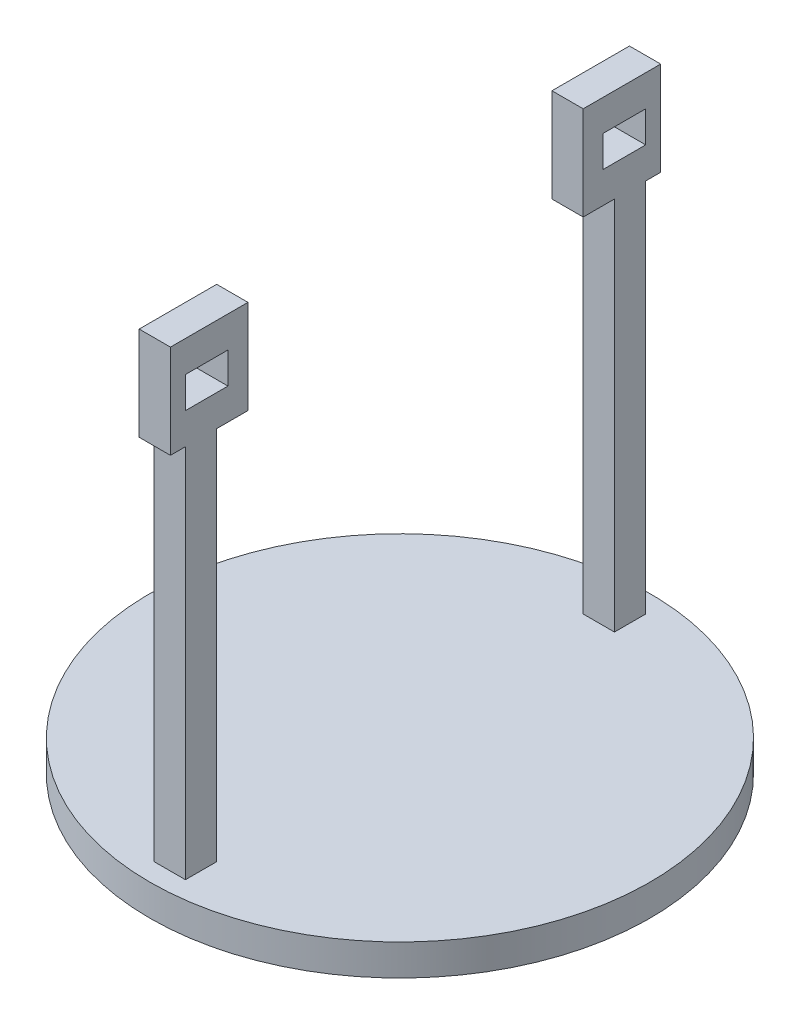
from build123d import *

# Parameters (mm, degrees)
SKETCH1_R           = 50.8
BOSS_EXTRUDE1_DEPTH = 6.35
SKETCH9_W           = 8.636
SKETCH9_H           = 6.35
BOSS_EXTRUDE5_DEPTH = 3.175


with BuildPart() as part:
    # Sketch1 → Boss-Extrude1 (new body)
    with BuildSketch(Plane(origin=(0, 0, 0), x_dir=(1, 0, 0), z_dir=(0, 1, 0))):
        Circle(SKETCH1_R)
    extrude(amount=BOSS_EXTRUDE1_DEPTH)

    # Sketch9 → Boss-Extrude5 (add, symmetric)
    with BuildSketch(Plane(origin=(0, 0, 0), x_dir=(0, 0, -1), z_dir=(1, 0, 0))):
        Polygon((40.408352, 82.55), (40.408352, 6.35), (46.758352, 6.35), (46.758352, 82.55), (49.806352, 82.55), (49.806352, 101.6), (34.058352, 101.6), (34.058352, 82.55), align=None)
        with Locations((42.440352, 92.075)):
            Rectangle(SKETCH9_W, SKETCH9_H, mode=Mode.SUBTRACT)
    boss_extrude5 = extrude(amount=BOSS_EXTRUDE5_DEPTH, both=True)

    # Mirror1: Boss-Extrude5 across plane
    add(boss_extrude5.mirror(Plane.XY))


solid = part.part
